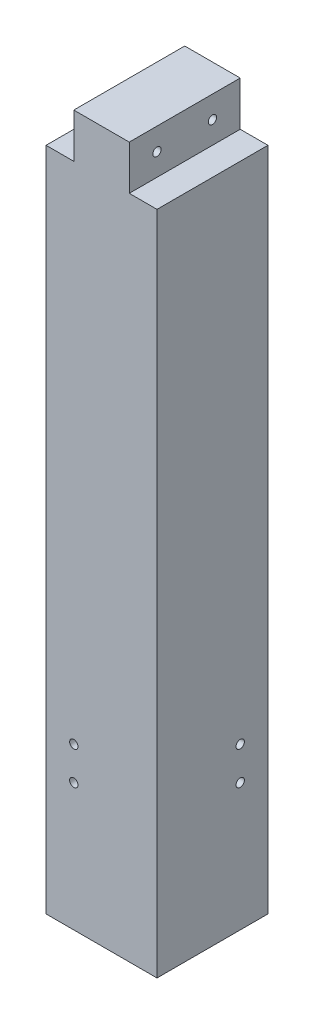
from build123d import *

# Parameters (mm, degrees)
BOSS_EXTRUDE1_DEPTH = 127
SKETCH4_W           = 31.75
SKETCH4_H           = 76.2
CUT_EXTRUDE3_DEPTH  = 63.5
SKETCH5_W           = 31.75
SKETCH5_H           = 76.2
CUT_EXTRUDE4_DEPTH  = 63.246
CUT_EXTRUDE6_DEPTH  = 69.85
CUT_EXTRUDE8_DEPTH  = 69.85
SKETCH9_R           = 4.7625
CUT_EXTRUDE9_DEPTH  = 461.057390442


with BuildPart() as part:
    # Sketch1 → Boss-Extrude1 (new body)
    with BuildSketch(Plane.XY):
        Polygon((63.5, -381), (63.5, 381), (31.75, 381), (31.75, 431.8), (-31.75, 431.8), (-31.75, 381), (-63.5, 381), (-63.5, -381), align=None)
    extrude(amount=-BOSS_EXTRUDE1_DEPTH)

    # Sketch4 → Cut-Extrude3 (cut)
    with BuildSketch(Plane.ZY.offset(63.5)):
        with Locations((-47.625, -215.9)):
            Rectangle(SKETCH4_W, SKETCH4_H)
    extrude(amount=-CUT_EXTRUDE3_DEPTH, mode=Mode.SUBTRACT)

    # Sketch5 → Cut-Extrude4 (cut)
    with BuildSketch(Plane(origin=(0, 0, -127), x_dir=(-1, 0, 0), z_dir=(0, 0, -1))):
        with Locations((-15.875, -215.9)):
            Rectangle(SKETCH5_W, SKETCH5_H)
    extrude(amount=-CUT_EXTRUDE4_DEPTH, mode=Mode.SUBTRACT)

    # Sketch7 → Cut-Extrude6 (cut)
    with BuildSketch(Plane(origin=(63.5, 0, 0), x_dir=(0, 0, -1), z_dir=(1, 0, 0))):
        with BuildLine():
            ThreePointArc((100.0125, -234.95), (98.617596045, -231.582403955), (95.25, -230.1875))
            Line((95.25, -230.1875), (95.25, -239.7125))
            ThreePointArc((95.25, -239.7125), (98.617596045, -238.317596045), (100.0125, -234.95))
        make_face()
        with BuildLine():
            Line((95.25, -239.7125), (95.25, -230.1875))
            ThreePointArc((95.25, -230.1875), (90.4875, -234.95), (95.25, -239.7125))
        make_face()
        with BuildLine():
            ThreePointArc((100.0125, -196.85), (98.617596045, -193.482403955), (95.25, -192.0875))
            Line((95.25, -192.0875), (95.25, -201.6125))
            ThreePointArc((95.25, -201.6125), (98.617596045, -200.217596045), (100.0125, -196.85))
        make_face()
        with BuildLine():
            Line((95.25, -201.6125), (95.25, -192.0875))
            ThreePointArc((95.25, -192.0875), (90.4875, -196.85), (95.25, -201.6125))
        make_face()
    extrude(amount=-CUT_EXTRUDE6_DEPTH, mode=Mode.SUBTRACT)

    # Sketch8 → Cut-Extrude8 (cut)
    with BuildSketch(Plane.XY):
        with BuildLine():
            ThreePointArc((-26.9875, -234.95), (-28.382403955, -231.582403955), (-31.75, -230.1875))
            Line((-31.75, -230.1875), (-31.75, -239.7125))
            ThreePointArc((-31.75, -239.7125), (-28.382403955, -238.317596045), (-26.9875, -234.95))
        make_face()
        with BuildLine():
            Line((-31.75, -239.7125), (-31.75, -230.1875))
            ThreePointArc((-31.75, -230.1875), (-36.5125, -234.95), (-31.75, -239.7125))
        make_face()
        with BuildLine():
            ThreePointArc((-26.9875, -196.85), (-28.382403955, -193.482403955), (-31.75, -192.0875))
            Line((-31.75, -192.0875), (-31.75, -201.6125))
            ThreePointArc((-31.75, -201.6125), (-28.382403955, -200.217596045), (-26.9875, -196.85))
        make_face()
        with BuildLine():
            Line((-31.75, -201.6125), (-31.75, -192.0875))
            ThreePointArc((-31.75, -192.0875), (-36.5125, -196.85), (-31.75, -201.6125))
        make_face()
    extrude(amount=-CUT_EXTRUDE8_DEPTH, mode=Mode.SUBTRACT)

    # Sketch9 → Cut-Extrude9 (cut, through all)
    with BuildSketch(Plane.ZY.offset(31.75)):
        with Locations(Location((-95.25, 406.4, 0), (0, 0, 270))):
            Circle(SKETCH9_R)
        with Locations(Location((-31.75, 406.4, 0), (0, 0, 270))):
            Circle(SKETCH9_R)
    extrude(amount=-CUT_EXTRUDE9_DEPTH, mode=Mode.SUBTRACT)


solid = part.part
